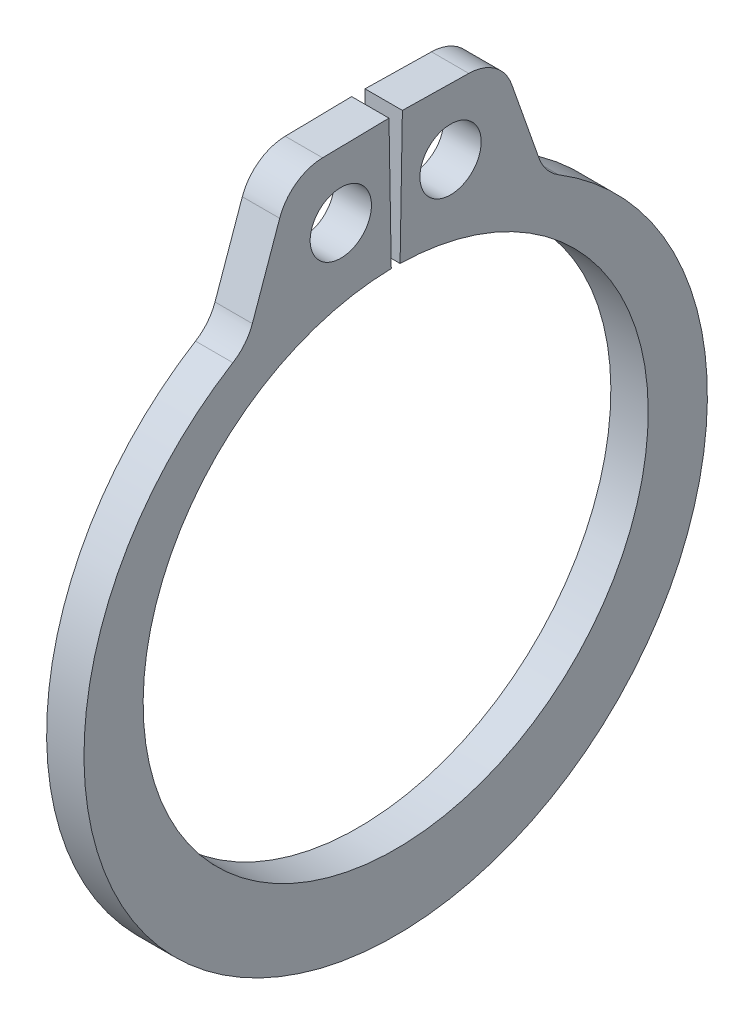
from build123d import *

# Parameters (mm, degrees)
SKETCH1_R      = 0.5207
EXTRUDE1_DEPTH = 0.3175
FILLET1_R      = 0.7874


with BuildPart() as part:
    # Sketch1 → Extrude1 (new, symmetric)
    with BuildSketch(Plane(origin=(0, 0, 0), x_dir=(0, 0, -1), z_dir=(1, 0, 0))):
        with BuildLine():
            Line((-0.0749162, 4.291946216), (-0.113925819, 6.526805784))
            Line((-0.113925819, 6.526805784), (-1.790070495, 6.49754857))
            Line((-1.790070495, 6.49754857), (-2.532309488, 4.3891842))
            ThreePointArc((-2.532309488, 4.3891842), (0, -5.5626), (2.532309488, 4.3891842))
            Line((2.532309488, 4.3891842), (1.790070495, 6.49754857))
            Line((1.790070495, 6.49754857), (0.113925819, 6.526805784))
            Line((0.113925819, 6.526805784), (0.0749162, 4.291946216))
            ThreePointArc((0.0749162, 4.291946216), (0, -4.2926), (-0.0749162, 4.291946216))
        make_face()
        with Locations((-0.932493347, 5.394747393)):
            Circle(SKETCH1_R, mode=Mode.SUBTRACT)
        with Locations((0.932493347, 5.394747393)):
            Circle(SKETCH1_R, mode=Mode.SUBTRACT)
    extrude(amount=EXTRUDE1_DEPTH, both=True)

    # Fillet1
    fillet1_edges = [part.edges().sort_by_distance(p)[0] for p in [
        (0, 6.49754857, -1.790070495),
        (0, 4.3891842, -2.532309488),
        (0, 4.3891842, 2.532309488),
        (0, 6.49754857, 1.790070495),
    ]]
    fillet(fillet1_edges, radius=FILLET1_R)


solid = part.part
